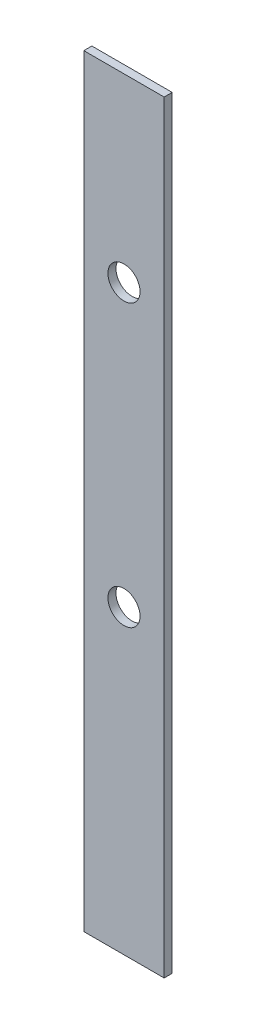
from build123d import *

# Parameters (mm, degrees)
SKETCH1_W           = 40
SKETCH1_H           = 380
BOSS_EXTRUDE1_DEPTH = 4
SKETCH2_R           = 8
CUT_EXTRUDE1_DEPTH  = 4


with BuildPart() as part:
    # Sketch1 → Boss-Extrude1 (new body)
    with BuildSketch(Plane.XY):
        Rectangle(SKETCH1_W, SKETCH1_H)
    extrude(amount=BOSS_EXTRUDE1_DEPTH)

    # Sketch2 → Cut-Extrude1 (cut)
    with BuildSketch(Plane(origin=(0, 0, 0), x_dir=(-1, 0, 0), z_dir=(0, 0, -1))):
        with Locations((0, 100)):
            Circle(SKETCH2_R)
        with Locations((0, -40)):
            Circle(SKETCH2_R)
    extrude(amount=-CUT_EXTRUDE1_DEPTH, mode=Mode.SUBTRACT)


solid = part.part
